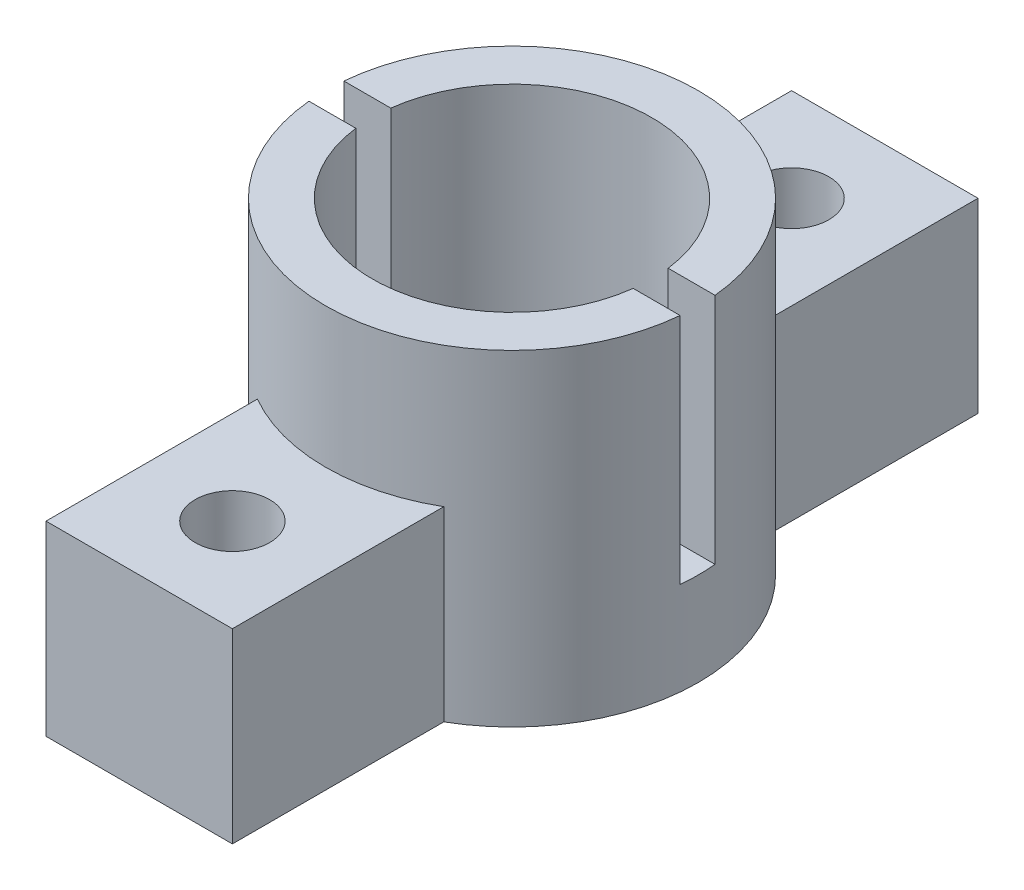
from build123d import *

# Parameters (mm, degrees)
ESQUISSE1_R             = 8
ESQUISSE1_R_2           = 6
BOSS_EXTRU_1_DEPTH      = 12
ESQUISSE1_3_R           = 6
ESQUISSE1_3_R_2         = 2
BOSS_EXTRU_2_DEPTH      = 2
ENL_V_START             = -8
ENL_V_MAT_EXTRU_1_DEPTH = 8
ESQUISSE3_R             = 1.6
BOSS_EXTRU_5_DEPTH      = 8
BOSS_EXTRU_6_DEPTH      = 2


with BuildPart() as part:
    # Esquisse1 → Boss.-Extru.1 (new body)
    with BuildSketch(Plane(origin=(0, 0, 0), x_dir=(1, 0, 0), z_dir=(0, 1, 0))):
        Circle(ESQUISSE1_R)
        Circle(ESQUISSE1_R_2, mode=Mode.SUBTRACT)
    extrude(amount=BOSS_EXTRU_1_DEPTH)

    # Esquisse1<3> → Boss.-Extru.2 (add)
    with BuildSketch(Plane(origin=(0, 0, 0), x_dir=(1, 0, 0), z_dir=(0, 1, 0))):
        Circle(ESQUISSE1_3_R)
        Circle(ESQUISSE1_3_R_2, mode=Mode.SUBTRACT)
    extrude(amount=BOSS_EXTRU_2_DEPTH)

    # Esquisse2 → Enlèv. mat.-Extru.1 (cut)
    with BuildSketch(Plane(origin=(0, 12, 0), x_dir=(1, 0, 0), z_dir=(0, 1, 0)).offset(ENL_V_START)):
        with BuildLine():
            ThreePointArc((-7.964766161, 0.75), (-8, 0), (-7.964766161, -0.75))
            Line((-7.964766161, -0.75), (-5.95294045, -0.75))
            ThreePointArc((-5.95294045, -0.75), (-6, 0), (-5.95294045, 0.75))
            Line((-5.95294045, 0.75), (-7.964766161, 0.75))
        make_face()
        with BuildLine():
            ThreePointArc((7.964766161, -0.75), (8, 0), (7.964766161, 0.75))
            Line((7.964766161, 0.75), (5.95294045, 0.75))
            ThreePointArc((5.95294045, 0.75), (6, 0), (5.95294045, -0.75))
            Line((5.95294045, -0.75), (7.964766161, -0.75))
        make_face()
    extrude(amount=ENL_V_MAT_EXTRU_1_DEPTH, mode=Mode.SUBTRACT)

    # Esquisse3 → Boss.-Extru.5 (add)
    # profile 1 of 2: a face of its own
    with BuildSketch(Plane.XZ):
        with BuildLine():
            Line((-4, -16), (4, -16))
            Line((4, -16), (4, -6.92820323))
            ThreePointArc((4, -6.92820323), (2.070552361, -7.72740661), (0, -8))
            ThreePointArc((0, -8), (-2.070552361, -7.72740661), (-4, -6.92820323))
            Line((-4, -6.92820323), (-4, -16))
        make_face()
        with Locations((0, -12)):
            Circle(ESQUISSE3_R, mode=Mode.SUBTRACT)
    # profile 2 of 2: a face of its own
    with BuildSketch(Plane.XZ):
        with BuildLine():
            Line((-4, 16), (-4, 6.92820323))
            ThreePointArc((-4, 6.92820323), (0, 8), (4, 6.92820323))
            Line((4, 6.92820323), (4, 16))
            Line((4, 16), (-4, 16))
        make_face()
        with Locations((0, 12)):
            Circle(ESQUISSE3_R, mode=Mode.SUBTRACT)
    extrude(amount=-BOSS_EXTRU_5_DEPTH)

    # Esquisse4 → Boss.-Extru.6 (add)
    with BuildSketch(Plane(origin=(0, 12, 0), x_dir=(1, 0, 0), z_dir=(0, 1, 0))):
        with BuildLine():
            Line((-5.95294045, -0.75), (-7.964766161, -0.75))
            ThreePointArc((-7.964766161, -0.75), (0, -8), (7.964766161, -0.75))
            Line((7.964766161, -0.75), (5.95294045, -0.75))
            ThreePointArc((5.95294045, -0.75), (0, -6), (-5.95294045, -0.75))
        make_face()
        with BuildLine():
            ThreePointArc((-5.95294045, 0.75), (0, 6), (5.95294045, 0.75))
            Line((5.95294045, 0.75), (7.964766161, 0.75))
            ThreePointArc((7.964766161, 0.75), (0, 8), (-7.964766161, 0.75))
            Line((-7.964766161, 0.75), (-5.95294045, 0.75))
        make_face()
    extrude(amount=BOSS_EXTRU_6_DEPTH)


solid = part.part
